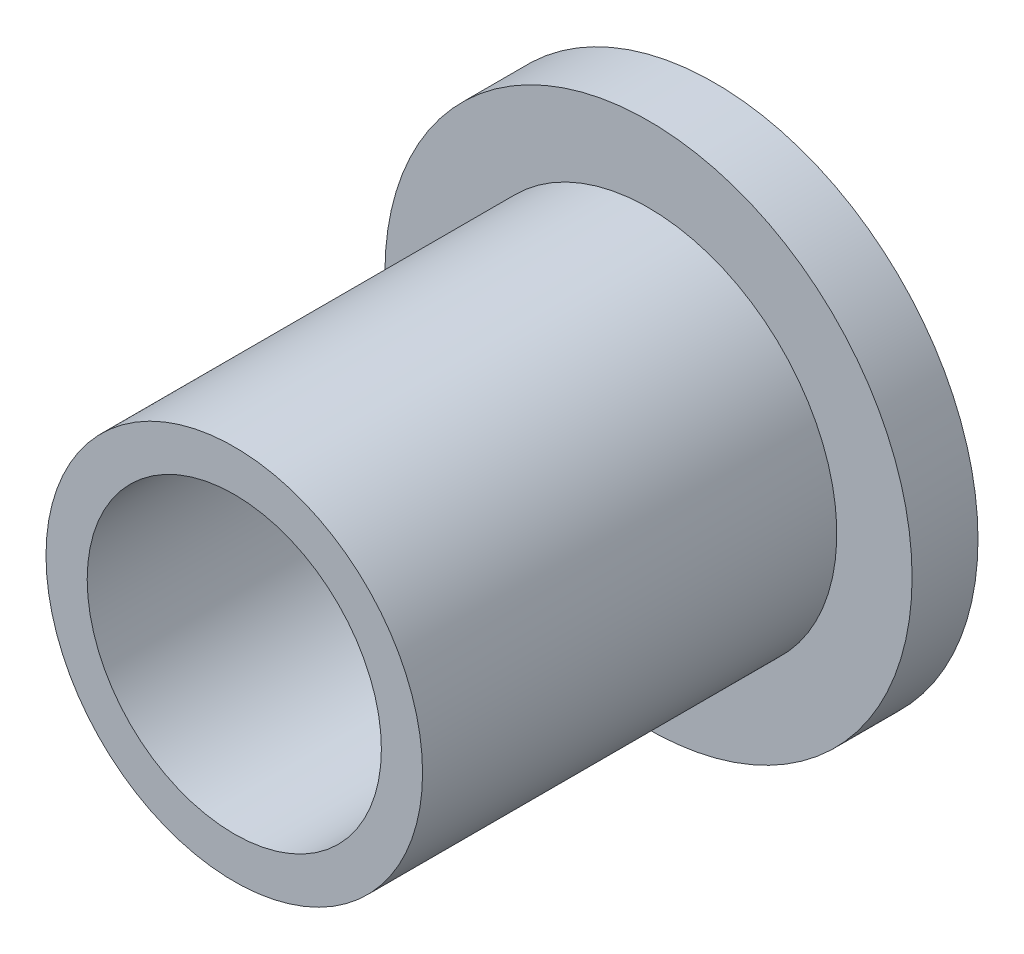
from build123d import *

# Parameters (mm, degrees)
SKETCH1_R      = 5.08
SKETCH1_R_2    = 3.96875
EXTRUDE1_DEPTH = 11.176
SKETCH2_R      = 7.112
SKETCH2_R_2    = 4.0005
EXTRUDE2_DEPTH = 1.778


with BuildPart() as part:
    # Sketch1 → Extrude1 (new body)
    with BuildSketch(Plane.XY):
        Circle(SKETCH1_R)
        Circle(SKETCH1_R_2, mode=Mode.SUBTRACT)
    extrude(amount=EXTRUDE1_DEPTH)

    # Sketch2 → Extrude2 (add)
    with BuildSketch(Plane(origin=(0, 0, 0), x_dir=(-1, 0, 0), z_dir=(0, 0, -1))):
        Circle(SKETCH2_R)
        Circle(SKETCH2_R_2, mode=Mode.SUBTRACT)
    extrude(amount=EXTRUDE2_DEPTH)


solid = part.part
